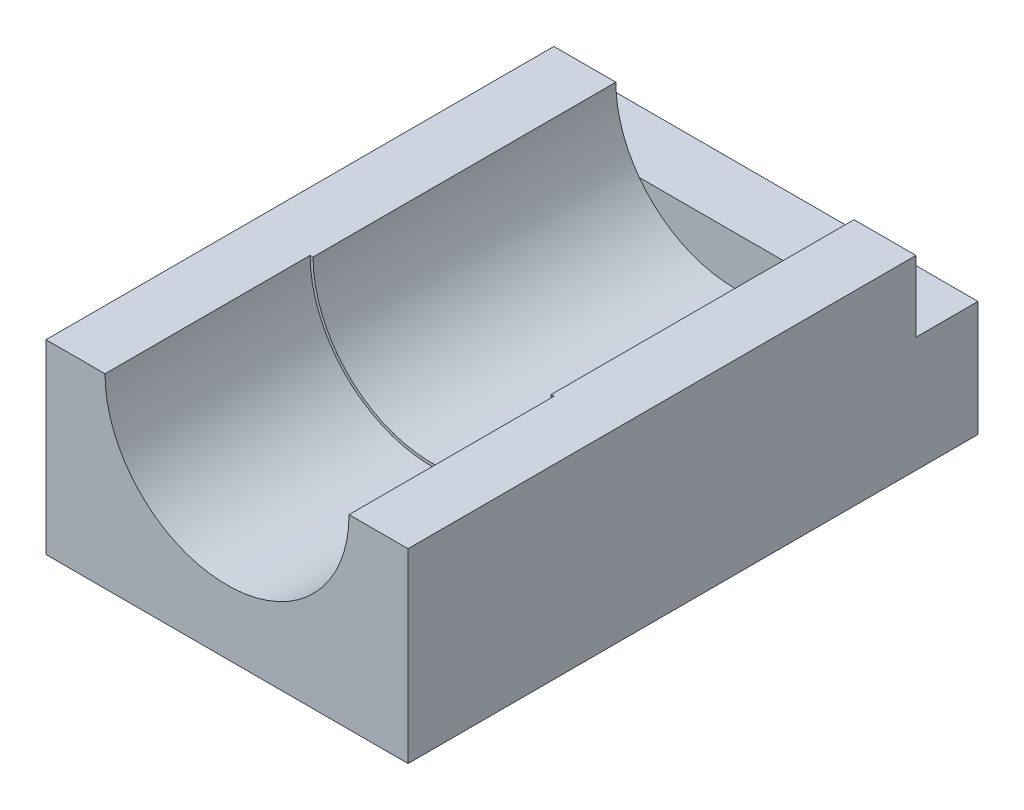
from build123d import *

# Parameters (mm, degrees)
BOSS_EXTRUDE1_DEPTH = 31
BOSS_EXTRUDE2_DEPTH = 21
SKETCH6_W           = 37.064796383
SKETCH6_H           = 11.800429223
BOSS_EXTRUDE3_DEPTH = 6.35
SKETCH8_R           = 2.000000064
CUT_EXTRUDE4_DEPTH  = 6.99999997


with BuildPart() as part:
    # Sketch1 → Boss-Extrude1 (new body)
    with BuildSketch(Plane.XY):
        with BuildLine():
            Line((23.763847258, 19.05), (23.763847258, 0))
            Line((23.763847258, 0), (-13.300949125, 0))
            Line((-13.300949125, 0), (-13.300949125, 19.05))
            Line((-13.300949125, 19.05), (-6.958949124, 19.05))
            ThreePointArc((-6.958949124, 19.05), (5.231449067, 6.859601809), (17.421847257, 19.05))
            Line((17.421847257, 19.05), (23.763847258, 19.05))
        make_face()
    extrude(amount=BOSS_EXTRUDE1_DEPTH)

    # Sketch3 → Boss-Extrude2 (add)
    with BuildSketch(Plane.XY.offset(31)):
        with BuildLine():
            Line((-13.300949125, 19.05), (-13.300949125, 0))
            Line((-13.300949125, 0), (23.763847258, 0))
            Line((23.763847258, 0), (23.763847258, 19.05))
            Line((23.763847258, 19.05), (17.72184715, 19.05))
            ThreePointArc((17.72184715, 19.05), (5.231449012, 6.559601862), (-7.258949126, 19.05))
            Line((-7.258949126, 19.05), (-13.300949125, 19.05))
        make_face()
    extrude(amount=BOSS_EXTRUDE2_DEPTH)

    # Sketch6 → Boss-Extrude3 (add)
    with BuildSketch(Plane(origin=(0, 0, 0), x_dir=(-1, 0, 0), z_dir=(0, 0, -1))):
        with Locations((-5.231449067, 5.900214612)):
            Rectangle(SKETCH6_W, SKETCH6_H)
    extrude(amount=BOSS_EXTRUDE3_DEPTH)

    # Sketch8 → Cut-Extrude4 (cut)
    with BuildSketch(Plane.XZ):
        with Locations(Location((-6.950949125, 45.65, 0), (0, 0, 270))):
            Circle(SKETCH8_R)
        with Locations(Location((-6.950949125, 0, 0), (0, 0, 270))):
            Circle(SKETCH8_R)
        with Locations(Location((17.413847258, 45.65, 0), (0, 0, 270))):
            Circle(SKETCH8_R)
        with Locations(Location((17.413847258, 0, 0), (0, 0, 270))):
            Circle(SKETCH8_R)
    extrude(amount=-CUT_EXTRUDE4_DEPTH, mode=Mode.SUBTRACT)


solid = part.part
